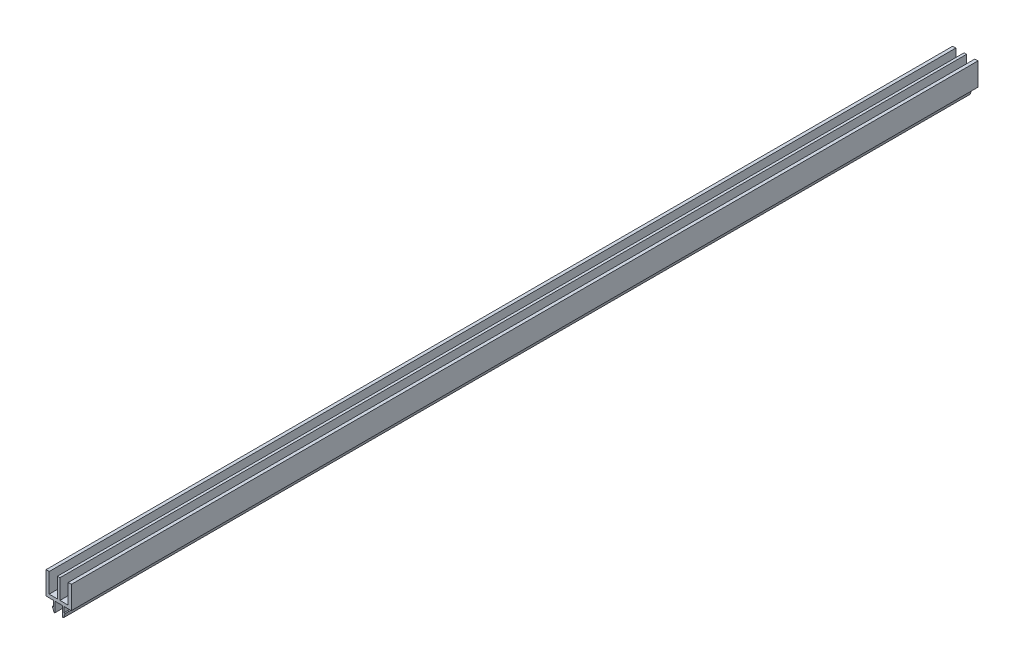
from build123d import *

# Parameters (mm, degrees)
BOSS_EXTRU_1_DEPTH = 715


with BuildPart() as part:
    # Esquisse1 → Boss.-Extru.1 (new body)
    with BuildSketch(Plane.XY.offset(50)):
        Polygon((-1, 2.5), (-7.5, 2.5), (-7.5, 17.999999998), (-10, 17.999999998), (-10, 0), (-4, 0), (-4, -4.5), (-5, -4.5), (-3.75, -8), (-3, -8), (-3, 0), (3, 0), (3, -8), (3.75, -8), (5, -4.5), (4, -4.5), (4, 0), (10, 0), (10, 17.999999998), (7.5, 17.999999998), (7.5, 2.5), (1, 2.5), (1, 17.999999998), (-1, 17.999999998), align=None)
    extrude(amount=-BOSS_EXTRU_1_DEPTH)


solid = part.part
